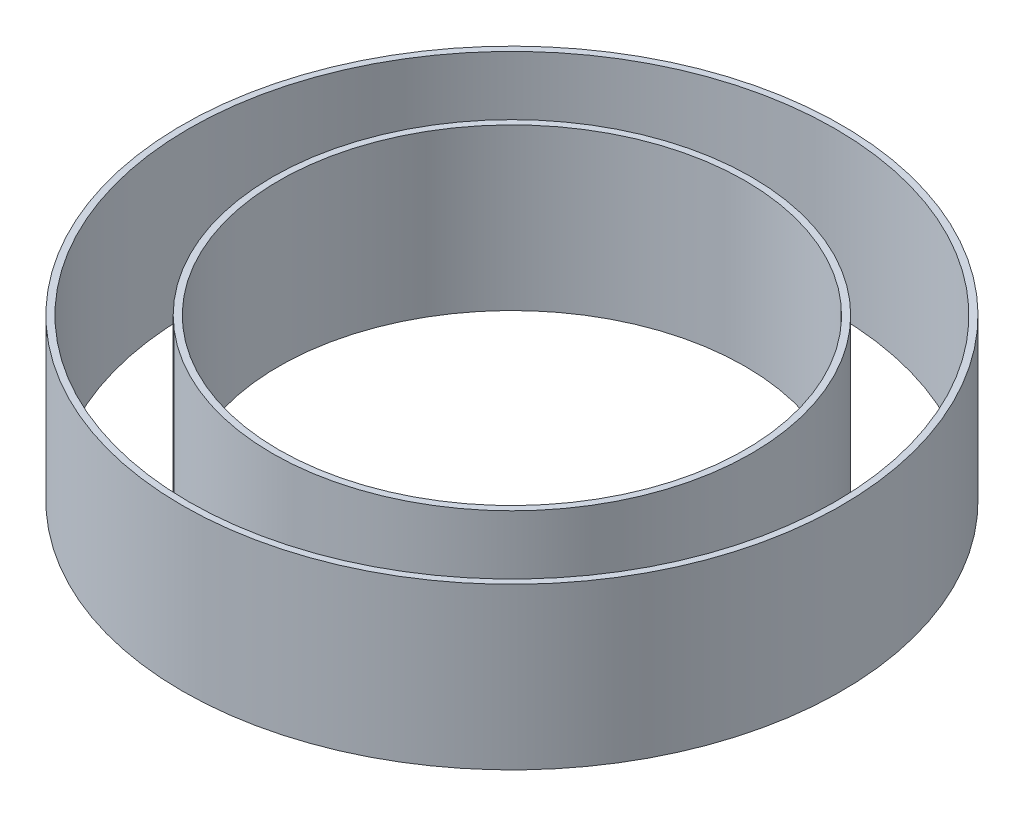
from build123d import *

# Parameters (mm, degrees)
SKETCH1_R             = 20.5
SKETCH1_R_2           = 20.1
BOSS_EXTRUDE1_DEPTH   = 5
SKETCH1_R_3           = 14.9
SKETCH1_R_4           = 14.5
BOSS_EXTRUDE1_2_DEPTH = 5


with BuildPart() as part:
    # Sketch1 → Boss-Extrude1 (new, symmetric)
    with BuildSketch(Plane(origin=(0, 0, 0), x_dir=(1, 0, 0), z_dir=(0, 1, 0))):
        with Locations(Location((0, 0, 0), (0, 0, 270))):
            Circle(SKETCH1_R)
        with Locations(Location((0, 0, 0), (0, 0, 270))):
            Circle(SKETCH1_R_2, mode=Mode.SUBTRACT)
    extrude(amount=BOSS_EXTRUDE1_DEPTH, both=True)


with BuildPart() as body_2:
    # Sketch1 → Boss-Extrude1 2 (new, symmetric)
    with BuildSketch(Plane(origin=(0, 0, 0), x_dir=(1, 0, 0), z_dir=(0, 1, 0))):
        with Locations(Location((0, 0, 0), (0, 0, 270))):
            Circle(SKETCH1_R_3)
        with Locations(Location((0, 0, 0), (0, 0, 270))):
            Circle(SKETCH1_R_4, mode=Mode.SUBTRACT)
    extrude(amount=BOSS_EXTRUDE1_2_DEPTH, both=True)


solid = Compound([part.part, body_2.part])
